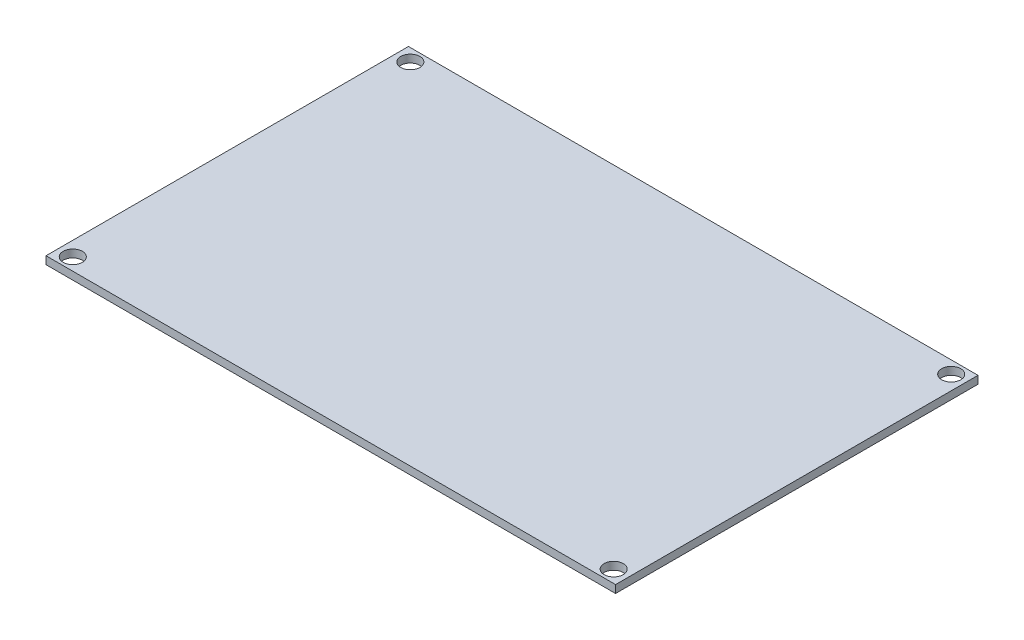
from build123d import *

# Parameters (mm, degrees)
IZIM1_W                     = 110
IZIM1_H                     = 70
Y_KSEKLIK_EKSTR_ZYON1_DEPTH = 1.5
IZIM2_R                     = 1.85
KES_EKSTR_ZYON1_DEPTH       = 1.5


with BuildPart() as part:
    # Çizim1 → Yükseklik-Ekstrüzyon1 (new body)
    with BuildSketch(Plane(origin=(0, 0, 0), x_dir=(1, 0, 0), z_dir=(0, 1, 0))):
        Rectangle(IZIM1_W, IZIM1_H)
    extrude(amount=Y_KSEKLIK_EKSTR_ZYON1_DEPTH)

    # Çizim2 → Kes-Ekstrüzyon1 (cut)
    with BuildSketch(Plane(origin=(0, 1.5, 0), x_dir=(1, 0, 0), z_dir=(0, 1, 0))):
        with Locations(Location((-52.232233048, 32.595869412, 0), (0, 0, 270))):
            Circle(IZIM2_R)
        with Locations(Location((52.232233048, 32.595869412, 0), (0, 0, 90))):
            Circle(IZIM2_R)
        with Locations(Location((52.232233048, -32.595869412, 0), (0, 0, 270))):
            Circle(IZIM2_R)
        with Locations(Location((-52.232233048, -32.595869412, 0), (0, 0, 90))):
            Circle(IZIM2_R)
    extrude(amount=-KES_EKSTR_ZYON1_DEPTH, mode=Mode.SUBTRACT)


solid = part.part
